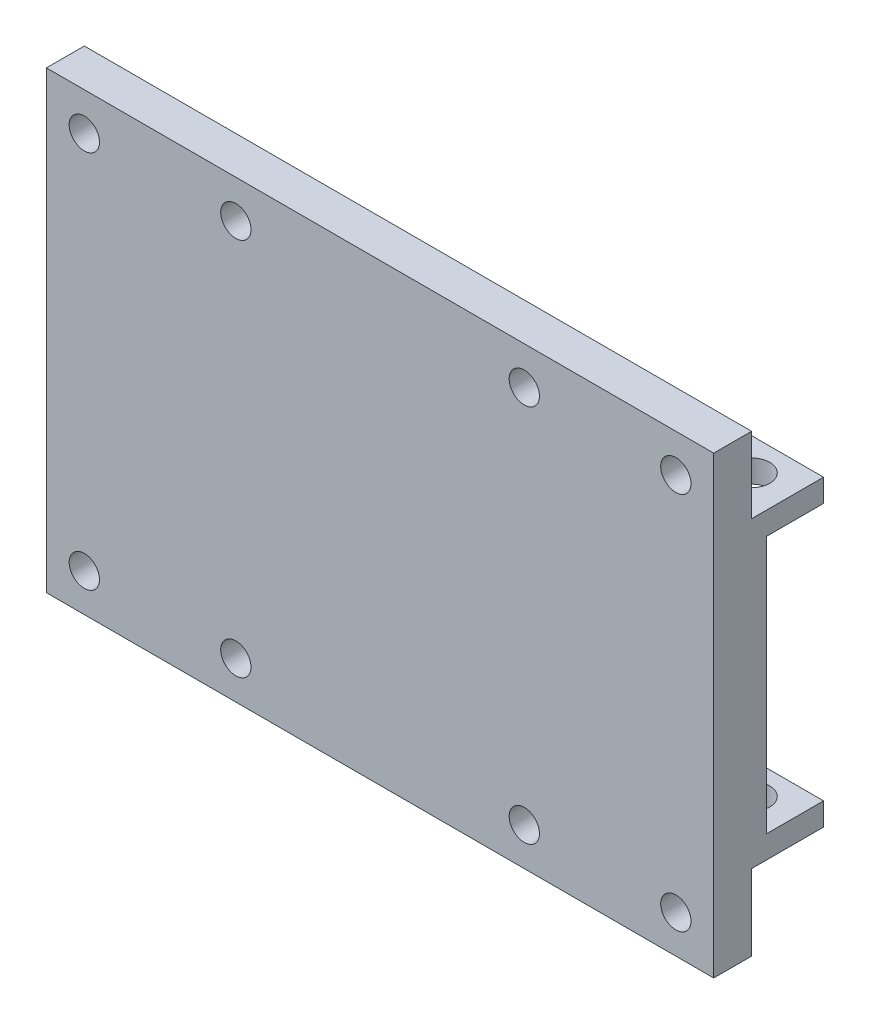
from build123d import *

# Parameters (mm, degrees)
SKETCH_1_W          = 88.07644651
SKETCH_1_H          = 60
EXTRUDE_1_DEPTH     = 5
SKETCH_3_W          = 32.5
SKETCH_3_H          = 3
EXTRUDE_2_DEPTH     = 9.5
SKETCH_4_R          = 2.4
CUT_EXTRUDE_2_DEPTH = 100
SKETCH_5_W          = 32.5
SKETCH_5_H          = 34
EXTRUDE_3_DEPTH     = 2
SKETCH_6_R          = 2
CUT_EXTRUDE_3_DEPTH = 10


with BuildPart() as part:
    # 草图1 → 凸台-拉伸1 (new body)
    with BuildSketch(Plane.XY):
        with Locations((-26.142212211, -6.928181841)):
            Rectangle(SKETCH_1_W, SKETCH_1_H)
    extrude(amount=EXTRUDE_1_DEPTH)

    # 草图3 → 凸台-拉伸2 (add)
    with BuildSketch(Plane(origin=(0, 0, 0), x_dir=(-1, 0, 0), z_dir=(0, 0, -1))):
        with Locations((-1.646011044, 11.571818159)):
            Rectangle(SKETCH_3_W, SKETCH_3_H)
        with Locations((53.930435466, 11.571818159)):
            Rectangle(SKETCH_3_W, SKETCH_3_H)
        with Locations((-1.646011044, -25.428181841)):
            Rectangle(SKETCH_3_W, SKETCH_3_H)
        with Locations((53.930435466, -25.428181841)):
            Rectangle(SKETCH_3_W, SKETCH_3_H)
    extrude(amount=EXTRUDE_2_DEPTH)

    # 草图4 → 切除-拉伸2 (cut)
    with BuildSketch(Plane(origin=(0, -26.928181841, 0), x_dir=(-1, 0, 0), z_dir=(0, -1, 0))):
        with Locations(Location((-12.646011044, 5.25, 0), (0, 0, 90))):
            Circle(SKETCH_4_R)
        with Locations(Location((9.353988956, 5.25, 0), (0, 0, 90))):
            Circle(SKETCH_4_R)
        with Locations(Location((42.930435466, 5.25, 0), (0, 0, 90))):
            Circle(SKETCH_4_R)
        with Locations(Location((64.930435466, 5.25, 0), (0, 0, 90))):
            Circle(SKETCH_4_R)
    extrude(amount=-CUT_EXTRUDE_2_DEPTH, mode=Mode.SUBTRACT)

    # 草图5 → 凸台-拉伸3 (add)
    with BuildSketch(Plane(origin=(0, 0, 0), x_dir=(-1, 0, 0), z_dir=(0, 0, -1))):
        with Locations((-1.646011044, -6.928181841)):
            Rectangle(SKETCH_5_W, SKETCH_5_H)
        with Locations((53.930435466, -6.928181841)):
            Rectangle(SKETCH_5_W, SKETCH_5_H)
    extrude(amount=EXTRUDE_3_DEPTH)

    # 草图6 → 切除-拉伸3 (cut)
    with BuildSketch(Plane(origin=(0, 0, 0), x_dir=(-1, 0, 0), z_dir=(0, 0, -1))):
        with Locations((-12.896011044, 18.071818159)):
            Circle(SKETCH_6_R)
        with Locations((-12.896011044, -31.928181841)):
            Circle(SKETCH_6_R)
        with Locations((7.103988956, 18.071818159)):
            Circle(SKETCH_6_R)
        with Locations((7.103988956, -31.928181841)):
            Circle(SKETCH_6_R)
        with Locations((65.180435466, 18.071818159)):
            Circle(SKETCH_6_R)
        with Locations((65.180435466, -31.928181841)):
            Circle(SKETCH_6_R)
        with Locations((45.180435466, 18.071818159)):
            Circle(SKETCH_6_R)
        with Locations((45.180435466, -31.928181841)):
            Circle(SKETCH_6_R)
    extrude(amount=-CUT_EXTRUDE_3_DEPTH, mode=Mode.SUBTRACT)


solid = part.part
